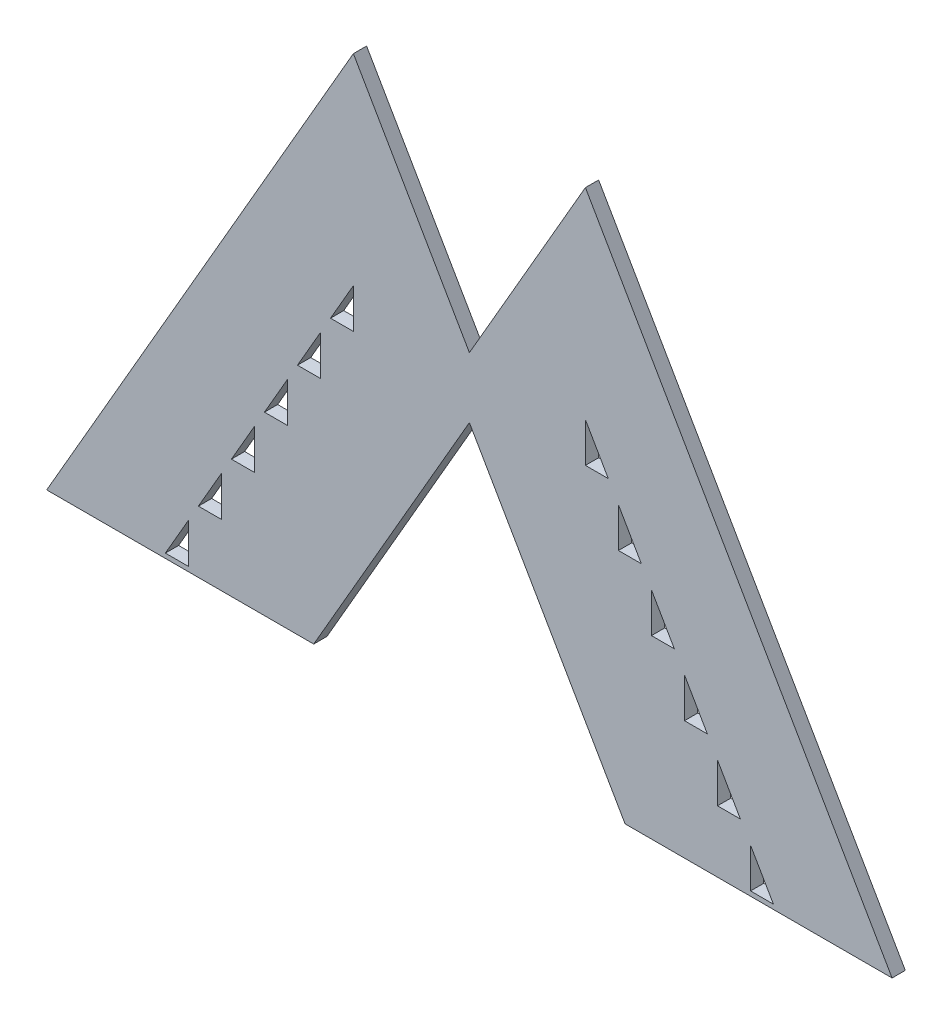
from build123d import *

# Parameters (mm, degrees)
EXTRUDE_1_DEPTH     = 1
CUT_EXTRUDE_1_DEPTH = 52.40107317
CUT_EXTRUDE_2_DEPTH = 10


with BuildPart() as part:
    # 草图1 → 凸台-拉伸1 (new body)
    with BuildSketch(Plane.XY):
        Polygon((-32, 0), (32, 0), (8.783121635, 40.212812921), (0, 25), (-8.783121635, 40.212812921), align=None)
    extrude(amount=EXTRUDE_1_DEPTH)

    # 草图2 → 切除-拉伸1 (cut, through all)
    with BuildSketch(Plane.XY.offset(1)):
        Polygon((-8.783121635, 25), (-10.515172443, 22), (-8.783121635, 22), align=None)
        Polygon((-11.283121635, 17.669872981), (-11.283121635, 20.669872981), (-13.015172443, 17.669872981), align=None)
        Polygon((-13.783121635, 13.339745962), (-13.783121635, 16.339745962), (-15.515172443, 13.339745962), align=None)
        Polygon((-16.283121635, 9.009618943), (-16.283121635, 12.009618943), (-18.015172443, 9.009618943), align=None)
        Polygon((-18.783121635, 4.679491924), (-18.783121635, 7.679491924), (-20.515172443, 4.679491924), align=None)
        Polygon((-21.283121635, 0.349364905), (-21.283121635, 3.349364905), (-23.015172443, 0.349364905), align=None)
        Polygon((23.015172443, 0.349364905), (21.283121635, 0.349364905), (21.283121635, 3.349364905), align=None)
        Polygon((20.515172443, 4.679491924), (18.783121635, 4.679491924), (18.783121635, 7.679491924), align=None)
        Polygon((18.015172443, 9.009618943), (16.283121635, 9.009618943), (16.283121635, 12.009618943), align=None)
        Polygon((15.515172443, 13.339745962), (13.783121635, 13.339745962), (13.783121635, 16.339745962), align=None)
        Polygon((13.015172443, 17.669872981), (11.283121635, 17.669872981), (11.283121635, 20.669872981), align=None)
        Polygon((10.515172443, 22), (8.783121635, 22), (8.783121635, 25), align=None)
    extrude(amount=-CUT_EXTRUDE_1_DEPTH, mode=Mode.SUBTRACT)

    # 草图3 → 切除-拉伸2 (cut)
    with BuildSketch(Plane.XY.offset(1)):
        Polygon((-11.785343035, 0), (0, 20.412812921), (11.785343035, 0), align=None)
    extrude(amount=-CUT_EXTRUDE_2_DEPTH, mode=Mode.SUBTRACT)


solid = part.part
